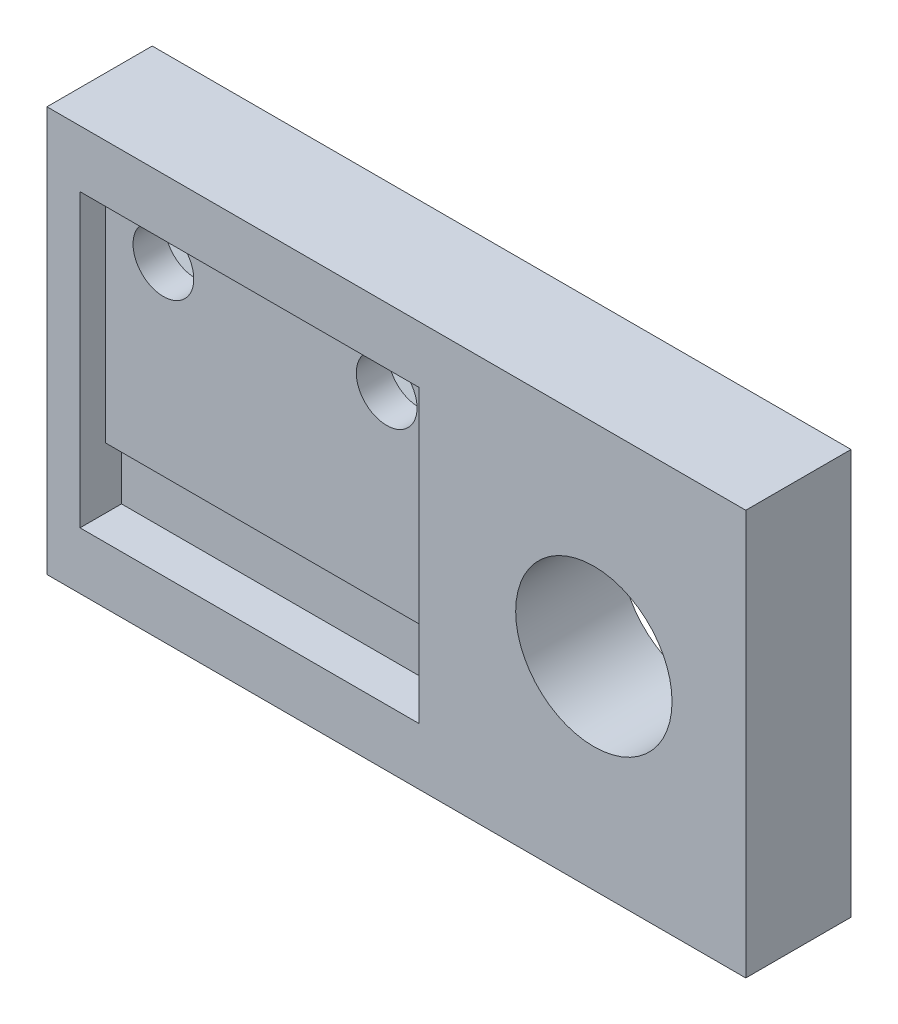
from build123d import *
from build123d.topology import SkipClean

# Parameters (mm, degrees)
SKETCH1_W           = 43.815
SKETCH1_H           = 25.4
SKETCH1_R           = 1.9039967
SKETCH1_R_2         = 4.9022
BOSS_EXTRUDE1_DEPTH = 2
SKETCH2_W           = 43.815
SKETCH2_H           = 25.4
SKETCH2_R           = 4.9022
SKETCH2_W_2         = 21.254
SKETCH2_H_2         = 18.254
BOSS_EXTRUDE2_DEPTH = 1.6
BOSS_EXTRUDE3_START = 3
SKETCH3_W           = 43.815
SKETCH3_H           = 25.4
SKETCH3_R           = 4.9022
BOSS_EXTRUDE3_DEPTH = 3
SKETCH5_W           = 21.254
SKETCH5_H           = 3.81
CUT_EXTRUDE1_DEPTH  = 1


with BuildPart() as part:
    # Sketch1 → Boss-Extrude1 (new body)
    with BuildSketch(Plane.XY):
        with Locations((21.9075, 12.7)):
            Rectangle(SKETCH1_W, SKETCH1_H)
        with Locations((5.7, 19.05)):
            Circle(SKETCH1_R, mode=Mode.SUBTRACT)
        with Locations((19.7, 19.05)):
            Circle(SKETCH1_R, mode=Mode.SUBTRACT)
        with Locations((34.29, 12.7)):
            Circle(SKETCH1_R_2, mode=Mode.SUBTRACT)
    extrude(amount=BOSS_EXTRUDE1_DEPTH)

    # Sketch2 → Boss-Extrude2 (add)
    with BuildSketch(Plane.XY.offset(2)):
        with Locations((21.9075, 12.7)):
            Rectangle(SKETCH2_W, SKETCH2_H)
        with Locations((34.29, 12.7)):
            Circle(SKETCH2_R, mode=Mode.SUBTRACT)
        with Locations((12.7, 12.7)):
            Rectangle(SKETCH2_W_2, SKETCH2_H_2, mode=Mode.SUBTRACT)
    extrude(amount=BOSS_EXTRUDE2_DEPTH)

    # Sketch3 → Boss-Extrude3 (add)
    with SkipClean():  # the faces are left unmerged after this step: merging them gives an invalid solid
        with BuildSketch(Plane(origin=(0, 0, 0), x_dir=(-1, 0, 0), z_dir=(0, 0, -1)).offset(BOSS_EXTRUDE3_START)):
            with Locations((-21.9075, 12.7)):
                Rectangle(SKETCH3_W, SKETCH3_H)
            with Locations((-34.29, 12.7)):
                Circle(SKETCH3_R, mode=Mode.SUBTRACT)
            Polygon((-16.5690055, 17.242319483), (-16.5690055, 20.857680517), (-19.7, 22.665361035), (-22.8309945, 20.857680517), (-22.8309945, 17.242319483), (-19.7, 15.434638965), align=None, mode=Mode.SUBTRACT)
            Polygon((-2.5690055, 20.857680517), (-5.7, 22.665361035), (-8.8309945, 20.857680517), (-8.8309945, 17.242319483), (-5.7, 15.434638965), (-2.5690055, 17.242319483), align=None, mode=Mode.SUBTRACT)
        extrude(amount=-BOSS_EXTRUDE3_DEPTH)

    # Sketch5 → Cut-Extrude1 (cut)
    with SkipClean():  # the faces are left unmerged after this step: merging them gives an invalid solid
        with BuildSketch(Plane.XY.offset(2)):
            with Locations((12.7, 5.478)):
                Rectangle(SKETCH5_W, SKETCH5_H)
        extrude(amount=-CUT_EXTRUDE1_DEPTH, mode=Mode.SUBTRACT)


solid = part.part
